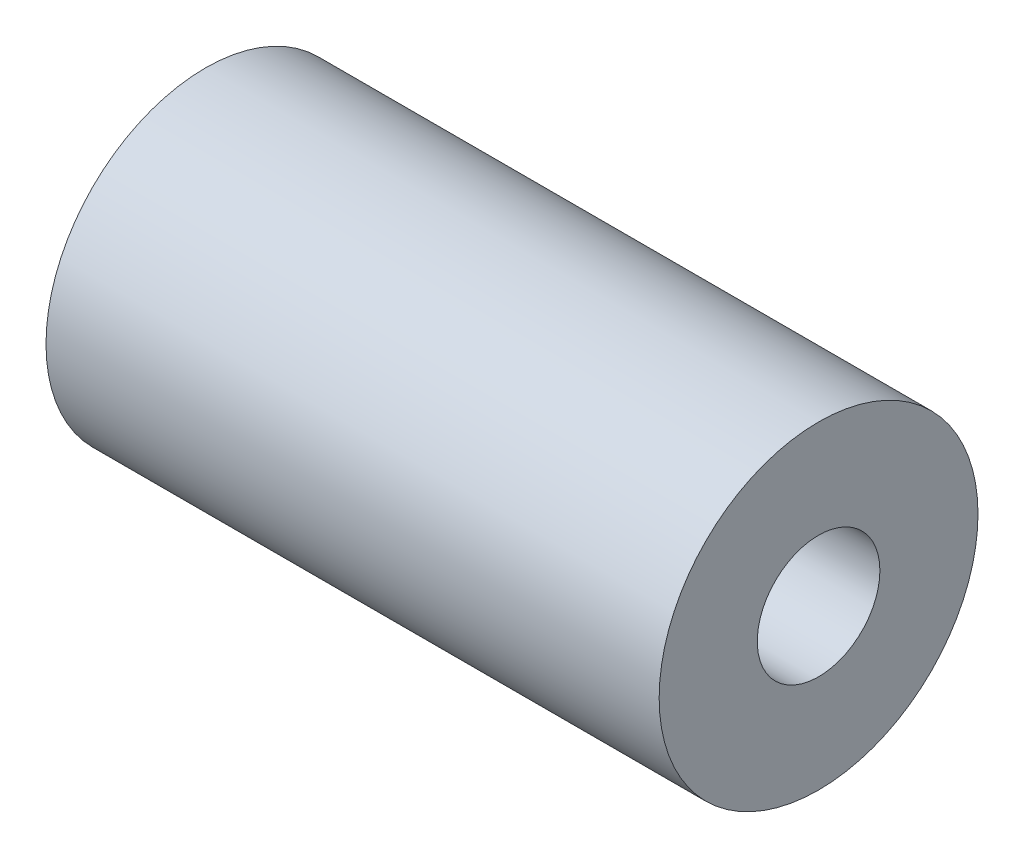
from build123d import *

# Parameters (mm, degrees)
SKETCH1_R           = 6.5
BOSS_EXTRUDE1_DEPTH = 12.5
SKETCH2_R           = 2.5
CUT_EXTRUDE1_DEPTH  = 12.5
SKETCH3_R           = 4
CUT_EXTRUDE2_DEPTH  = 12.5


with BuildPart() as part:
    # Sketch1 → Boss-Extrude1 (new, symmetric)
    with BuildSketch(Plane(origin=(0, 0, 0), x_dir=(0, 0, -1), z_dir=(1, 0, 0))):
        Circle(SKETCH1_R)
    extrude(amount=BOSS_EXTRUDE1_DEPTH, both=True)

    # Sketch2 → Cut-Extrude1 (cut)
    with BuildSketch(Plane(origin=(12.5, 0, 0), x_dir=(0, 0, -1), z_dir=(1, 0, 0))):
        Circle(SKETCH2_R)
    extrude(amount=-CUT_EXTRUDE1_DEPTH, mode=Mode.SUBTRACT)

    # Sketch3 → Cut-Extrude2 (cut)
    with BuildSketch(Plane.ZY.offset(12.5)):
        Circle(SKETCH3_R)
    extrude(amount=-CUT_EXTRUDE2_DEPTH, mode=Mode.SUBTRACT)


solid = part.part
